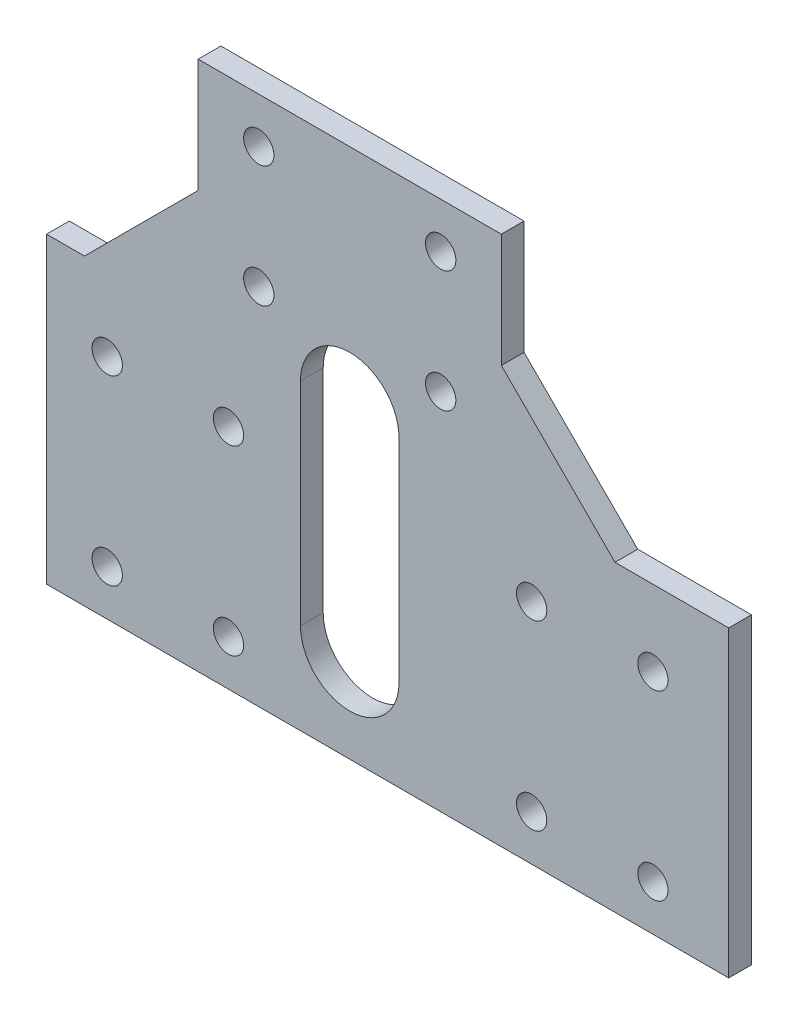
from build123d import *

# Parameters (mm, degrees)
EXTRUDE_1_DEPTH     = 3
SKETCH_2_R          = 2
CUT_EXTRUDE_1_DEPTH = 3


with BuildPart() as part:
    # 草图1 → 凸台-拉伸1 (new body)
    with BuildSketch(Plane.XY):
        Polygon((0, 0), (0, 40), (5, 40), (20, 55), (20, 70), (60, 70), (60, 55), (75, 40), (90, 40), (90, 0), align=None)
    extrude(amount=EXTRUDE_1_DEPTH)

    # 草图2 → 切除-拉伸1 (cut)
    with BuildSketch(Plane.XY.offset(3)):
        with Locations((28, 64)):
            Circle(SKETCH_2_R)
        with Locations((28, 48)):
            Circle(SKETCH_2_R)
        with Locations((52, 64)):
            Circle(SKETCH_2_R)
        with Locations((52, 48)):
            Circle(SKETCH_2_R)
        with Locations((8, 30)):
            Circle(SKETCH_2_R)
        with Locations((24, 30)):
            Circle(SKETCH_2_R)
        with Locations((80, 30)):
            Circle(SKETCH_2_R)
        with Locations((64, 30)):
            Circle(SKETCH_2_R)
        with Locations((80, 6)):
            Circle(SKETCH_2_R)
        with Locations((64, 6)):
            Circle(SKETCH_2_R)
        with Locations((24, 6)):
            Circle(SKETCH_2_R)
        with Locations((8, 6)):
            Circle(SKETCH_2_R)
        with BuildLine():
            Line((46.5, 40), (46.5, 12))
            ThreePointArc((46.5, 12), (40, 5.5), (33.5, 12))
            Line((33.5, 12), (33.5, 40))
            ThreePointArc((33.5, 40), (40, 46.5), (46.5, 40))
        make_face()
    extrude(amount=-CUT_EXTRUDE_1_DEPTH, mode=Mode.SUBTRACT)


solid = part.part
